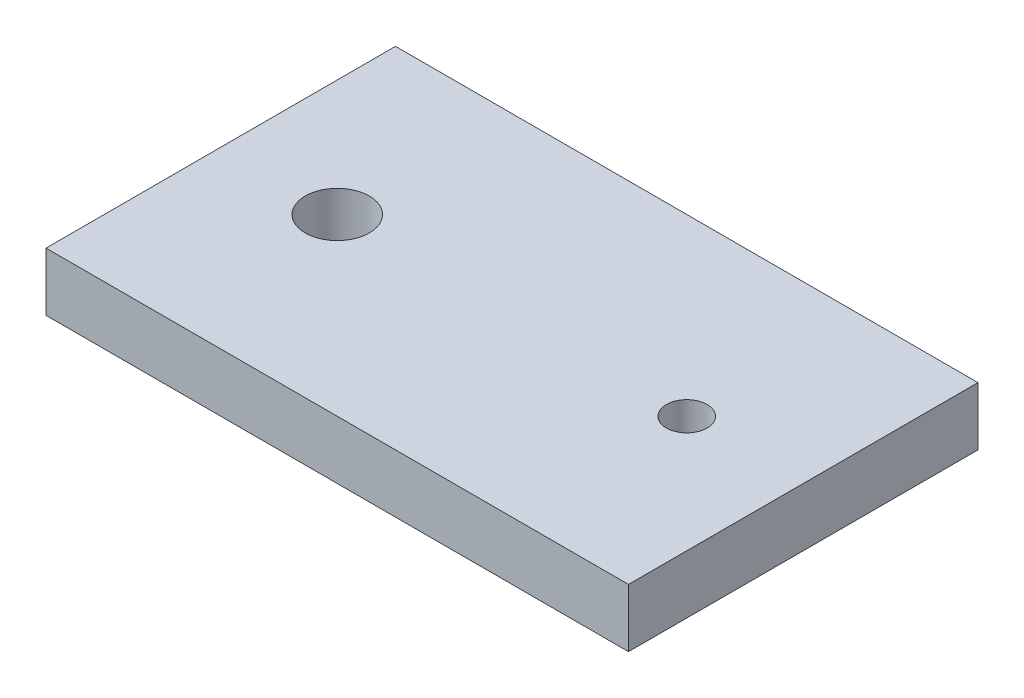
from build123d import *

# Parameters (mm, degrees)
SKETCH_1_W      = 50
SKETCH_1_H      = 30
SKETCH_1_R      = 2.75
SKETCH_1_R_2    = 1.75
EXTRUDE_1_DEPTH = 5


with BuildPart() as part:
    # 草图1 → 凸台-拉伸1 (new body)
    with BuildSketch(Plane(origin=(0, 0, 0), x_dir=(1, 0, 0), z_dir=(0, 1, 0))):
        with Locations((0.868725869, -2.113899614)):
            Rectangle(SKETCH_1_W, SKETCH_1_H)
        with Locations(Location((-14.131274131, -2.113899614, 0), (0, 0, 270))):
            Circle(SKETCH_1_R, mode=Mode.SUBTRACT)
        with Locations(Location((15.868725869, -2.113899614, 0), (0, 0, 270))):
            Circle(SKETCH_1_R_2, mode=Mode.SUBTRACT)
    extrude(amount=EXTRUDE_1_DEPTH)


solid = part.part
